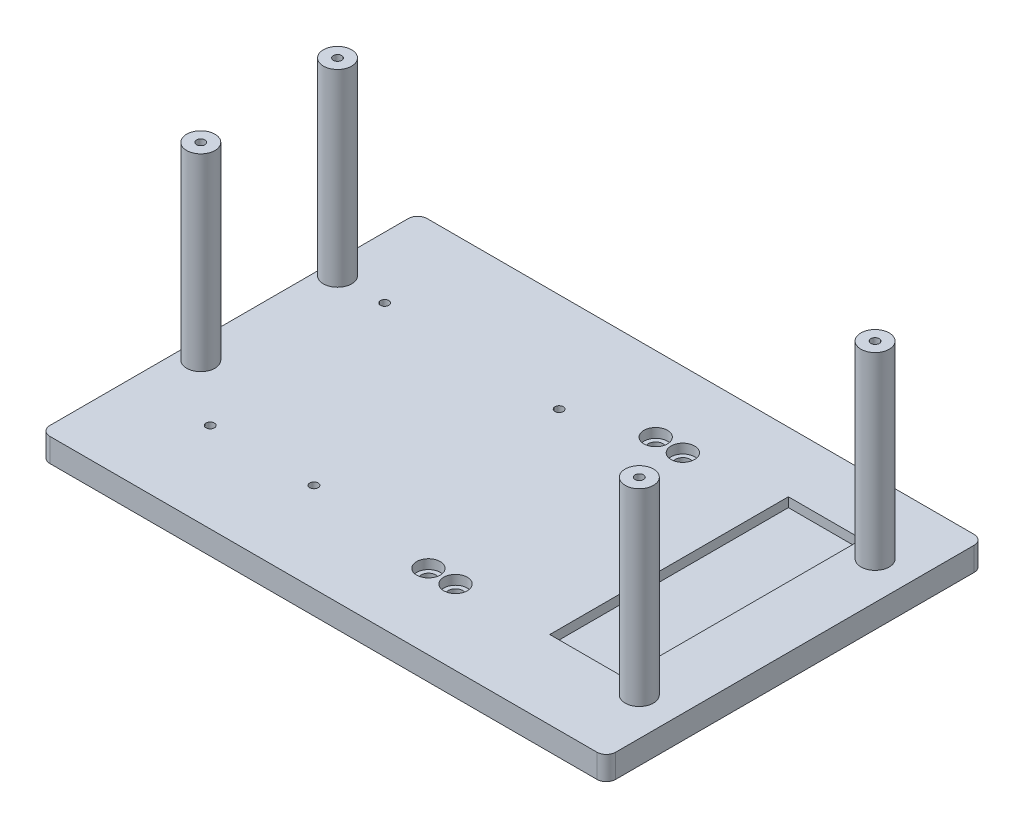
from build123d import *

# Parameters (mm, degrees)
SKETCH1_W           = 152.4
SKETCH1_H           = 101.6
BOSS_EXTRUDE1_DEPTH = 6.35
SKETCH2_R           = 3.81
BOSS_EXTRUDE2_DEPTH = 50.8
SKETCH3_R           = 1.1303
CUT_EXTRUDE2_DEPTH  = 12.7
CUT_EXTRUDE3_DEPTH  = 6.35
SKETCH6_W           = 30.413113892
SKETCH6_H           = 50.8
BOSS_EXTRUDE3_DEPTH = 25.4
SKETCH8_W           = 30.413113892
SKETCH8_H           = 50.8
CUT_EXTRUDE4_DEPTH  = 25.4
SKETCH9_R           = 3.175
CUT_EXTRUDE5_DEPTH  = 2.54
SKETCH10_W          = 19.812
SKETCH10_H          = 64.262
CUT_EXTRUDE6_DEPTH  = 2.54
SKETCH12_R          = 1.1303
CUT_EXTRUDE7_DEPTH  = 132.950059198
FILLET1_R           = 2.54


with BuildPart() as part:
    # Sketch1 → Boss-Extrude1 (new body)
    with BuildSketch(Plane(origin=(0, 0, 0), x_dir=(1, 0, 0), z_dir=(0, 1, 0))):
        with Locations((28.027586207, -12.182445141)):
            Rectangle(SKETCH1_W, SKETCH1_H)
    extrude(amount=BOSS_EXTRUDE1_DEPTH)

    # Sketch2 → Boss-Extrude2 (add)
    with BuildSketch(Plane(origin=(0, 6.35, 0), x_dir=(1, 0, 0), z_dir=(0, 1, 0))):
        with Locations(Location((-44.362413793, 13.217554859, 0), (0, 0, 180))):
            Circle(SKETCH2_R)
        with Locations(Location((-43.092413793, -24.882445141, 0), (0, 0, 270))):
            Circle(SKETCH2_R)
        with Locations(Location((94.067586207, 19.567554859, 0), (0, 0, 270))):
            Circle(SKETCH2_R)
        with Locations(Location((94.067586207, -43.932445141, 0), (0, 0, 270))):
            Circle(SKETCH2_R)
    extrude(amount=BOSS_EXTRUDE2_DEPTH)

    # Sketch3 → Cut-Extrude2 (cut)
    with BuildSketch(Plane(origin=(0, 57.15, 0), x_dir=(1, 0, 0), z_dir=(0, 1, 0))):
        with Locations(Location((-44.362413793, 13.217554859, 0), (0, 0, 270))):
            Circle(SKETCH3_R)
        with Locations(Location((94.067586207, -43.932445141, 0), (0, 0, 270))):
            Circle(SKETCH3_R)
        with Locations(Location((94.067586207, 19.567554859, 0), (0, 0, 270))):
            Circle(SKETCH3_R)
        with Locations(Location((-43.092413793, -24.882445141, 0), (0, 0, 270))):
            Circle(SKETCH3_R)
    extrude(amount=-CUT_EXTRUDE2_DEPTH, mode=Mode.SUBTRACT)

    # Sketch4 → Cut-Extrude3 (cut)
    with BuildSketch(Plane.XZ):
        with BuildLine():
            ThreePointArc((38.123586207, 42.789445141), (37.537799769, 44.203658703), (36.123586207, 44.789445141))
            Line((36.123586207, 44.789445141), (36.123586207, 42.789445141))
            Line((36.123586207, 42.789445141), (36.123586207, 40.789445141))
            ThreePointArc((36.123586207, 40.789445141), (37.537799769, 41.375231579), (38.123586207, 42.789445141))
        make_face()
        with BuildLine():
            Line((36.123586207, 42.789445141), (36.123586207, 44.789445141))
            ThreePointArc((36.123586207, 44.789445141), (34.123586207, 42.789445141), (36.123586207, 40.789445141))
            Line((36.123586207, 40.789445141), (36.123586207, 42.789445141))
        make_face()
        with BuildLine():
            ThreePointArc((38.123586207, 42.789445141), (37.537799769, 44.203658703), (36.123586207, 44.789445141))
            Line((36.123586207, 44.789445141), (36.123586207, 42.789445141))
            Line((36.123586207, 42.789445141), (36.123586207, 40.789445141))
            ThreePointArc((36.123586207, 40.789445141), (37.537799769, 41.375231579), (38.123586207, 42.789445141))
        make_face()
        with BuildLine():
            Line((36.123586207, 42.789445141), (36.123586207, 44.789445141))
            ThreePointArc((36.123586207, 44.789445141), (34.123586207, 42.789445141), (36.123586207, 40.789445141))
            Line((36.123586207, 40.789445141), (36.123586207, 42.789445141))
        make_face()
        with BuildLine():
            ThreePointArc((45.426586207, 42.789445141), (44.840799769, 44.203658703), (43.426586207, 44.789445141))
            Line((43.426586207, 44.789445141), (43.426586207, 42.789445141))
            Line((43.426586207, 42.789445141), (43.426586207, 40.789445141))
            ThreePointArc((43.426586207, 40.789445141), (44.840799769, 41.375231579), (45.426586207, 42.789445141))
        make_face()
        with BuildLine():
            Line((43.426586207, 42.789445141), (43.426586207, 44.789445141))
            ThreePointArc((43.426586207, 44.789445141), (41.426586207, 42.789445141), (43.426586207, 40.789445141))
            Line((43.426586207, 40.789445141), (43.426586207, 42.789445141))
        make_face()
        with BuildLine():
            ThreePointArc((45.426586207, 42.789445141), (44.840799769, 44.203658703), (43.426586207, 44.789445141))
            Line((43.426586207, 44.789445141), (43.426586207, 42.789445141))
            Line((43.426586207, 42.789445141), (43.426586207, 40.789445141))
            ThreePointArc((43.426586207, 40.789445141), (44.840799769, 41.375231579), (45.426586207, 42.789445141))
        make_face()
        with BuildLine():
            Line((43.426586207, 42.789445141), (43.426586207, 44.789445141))
            ThreePointArc((43.426586207, 44.789445141), (41.426586207, 42.789445141), (43.426586207, 40.789445141))
            Line((43.426586207, 40.789445141), (43.426586207, 42.789445141))
        make_face()
    cut_extrude3 = extrude(amount=-CUT_EXTRUDE3_DEPTH, mode=Mode.SUBTRACT)

    # Sketch6 → Boss-Extrude3 (add)
    with BuildSketch(Plane(origin=(0, 6.35, 0), x_dir=(1, 0, 0), z_dir=(0, 1, 0))):
        with Locations((33.36893454, 13.217554859)):
            Rectangle(SKETCH6_W, SKETCH6_H)
    extrude(amount=BOSS_EXTRUDE3_DEPTH)

    # Mirror1: Cut-Extrude3 across plane
    add(cut_extrude3.mirror(Plane(origin=(48.575491486, 31.75, 12.182445141), x_dir=(1, 0, 0), z_dir=(0, 0, -1))), mode=Mode.SUBTRACT)

    # Sketch8 → Cut-Extrude4 (cut)
    with BuildSketch(Plane(origin=(0, 31.75, 0), x_dir=(1, 0, 0), z_dir=(0, 1, 0))):
        with Locations((33.36893454, 13.217554859)):
            Rectangle(SKETCH8_W, SKETCH8_H)
    extrude(amount=-CUT_EXTRUDE4_DEPTH, mode=Mode.SUBTRACT)

    # Sketch9 → Cut-Extrude5 (cut)
    with BuildSketch(Plane(origin=(0, 6.35, 0), x_dir=(1, 0, 0), z_dir=(0, 1, 0))):
        with Locations(Location((43.426586207, 18.424554859, 0), (0, 0, 270))):
            Circle(SKETCH9_R)
        with Locations(Location((36.123586207, 18.424554859, 0), (0, 0, 270))):
            Circle(SKETCH9_R)
        with Locations(Location((43.426586207, -42.789445141, 0), (0, 0, 270))):
            Circle(SKETCH9_R)
        with Locations(Location((36.123586207, -42.789445141, 0), (0, 0, 270))):
            Circle(SKETCH9_R)
    extrude(amount=-CUT_EXTRUDE5_DEPTH, mode=Mode.SUBTRACT)

    # Sketch10 → Cut-Extrude6 (cut)
    with BuildSketch(Plane(origin=(0, 6.35, 0), x_dir=(1, 0, 0), z_dir=(0, 1, 0))):
        with Locations((77.811586207, -9.756234071)):
            Rectangle(SKETCH10_W, SKETCH10_H)
    extrude(amount=-CUT_EXTRUDE6_DEPTH, mode=Mode.SUBTRACT)

    # Sketch12 → Cut-Extrude7 (cut, through all)
    with BuildSketch(Plane(origin=(0, 6.35, 0), x_dir=(1, 0, 0), z_dir=(0, 1, 0))):
        with Locations(Location((-31.662413793, 13.217554859, 0), (0, 0, 270))):
            Circle(SKETCH12_R)
        with Locations(Location((16.597586207, 11.947554859, 0), (0, 0, 270))):
            Circle(SKETCH12_R)
        with Locations(Location((1.357586207, -38.852445141, 0), (0, 0, 270))):
            Circle(SKETCH12_R)
        with Locations(Location((-26.582413793, -38.852445141, 0), (0, 0, 270))):
            Circle(SKETCH12_R)
    extrude(amount=-CUT_EXTRUDE7_DEPTH, mode=Mode.SUBTRACT)

    # Fillet1
    fillet1_edges = [part.edges().sort_by_distance(p)[0] for p in [
        (-48.172413793, 3.175, -38.617554859),
        (104.227586207, 3.175, -38.617554859),
        (104.227586207, 3.175, 62.982445141),
        (-48.172413793, 3.175, 62.982445141),
    ]]
    fillet(fillet1_edges, radius=FILLET1_R)


solid = part.part
